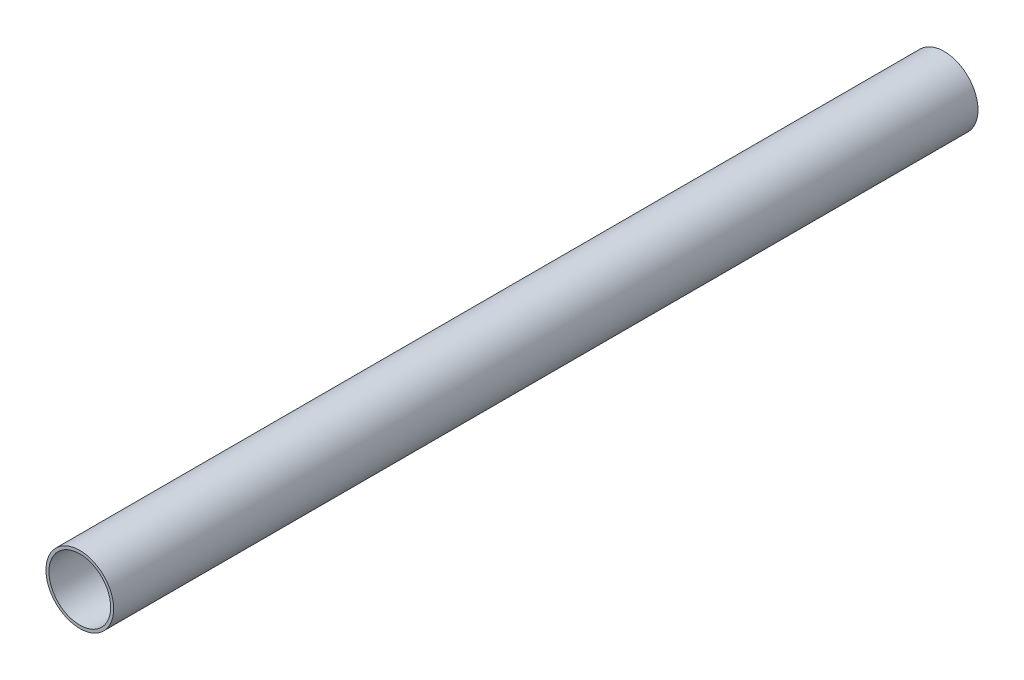
from build123d import *

# Parameters (mm, degrees)
SKETCH1_R           = 13.930255965
SKETCH1_R_2         = 12.7
BOSS_EXTRUDE1_DEPTH = 177.8


with BuildPart() as part:
    # Sketch1 → Boss-Extrude1 (new, symmetric)
    with BuildSketch(Plane.XY):
        Circle(SKETCH1_R)
        Circle(SKETCH1_R_2, mode=Mode.SUBTRACT)
    extrude(amount=BOSS_EXTRUDE1_DEPTH, both=True)


solid = part.part
